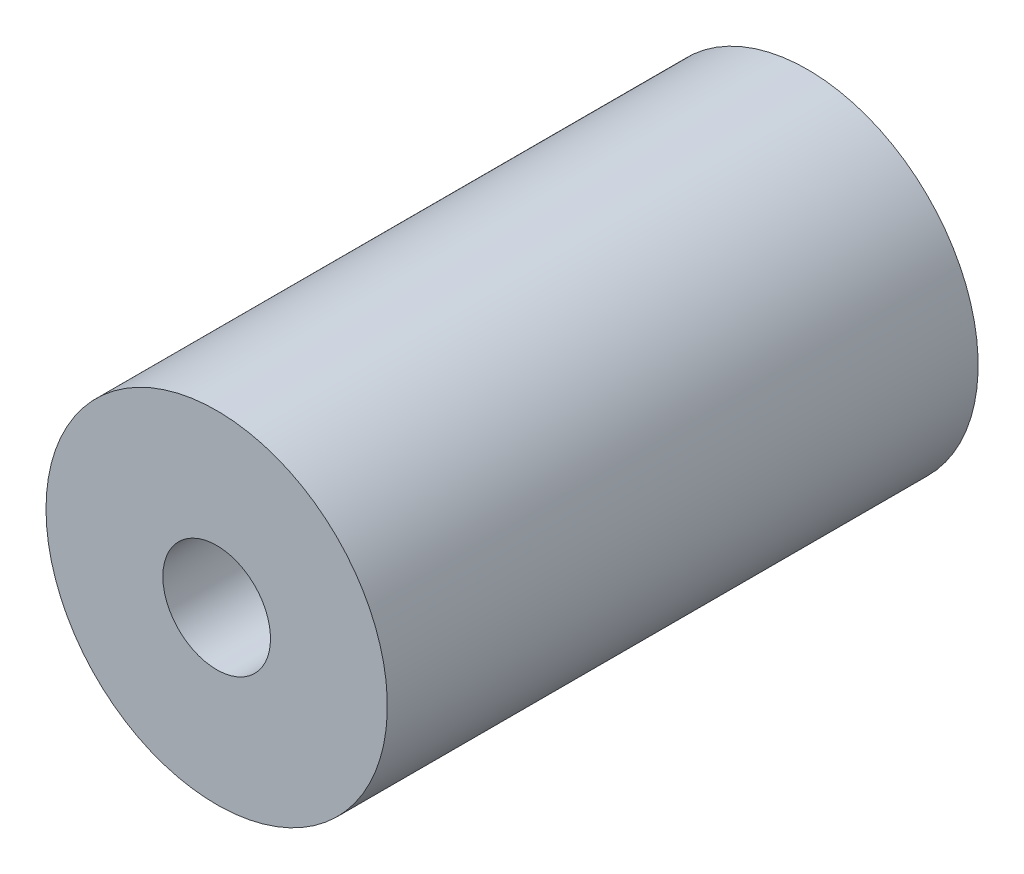
from build123d import *

# Parameters (mm, degrees)
SKETCH_1_R      = 13
SKETCH_1_R_2    = 4.1
EXTRUDE_1_DEPTH = 45


with BuildPart() as part:
    # Эскиз1 → Вытянуть1 (new body)
    with BuildSketch(Plane.XY):
        with Locations(Location((0, 0, 0), (0, 0, 180))):
            Circle(SKETCH_1_R)
        with Locations(Location((0, 0, 0), (0, 0, 180))):
            Circle(SKETCH_1_R_2, mode=Mode.SUBTRACT)
    extrude(amount=EXTRUDE_1_DEPTH)


solid = part.part
